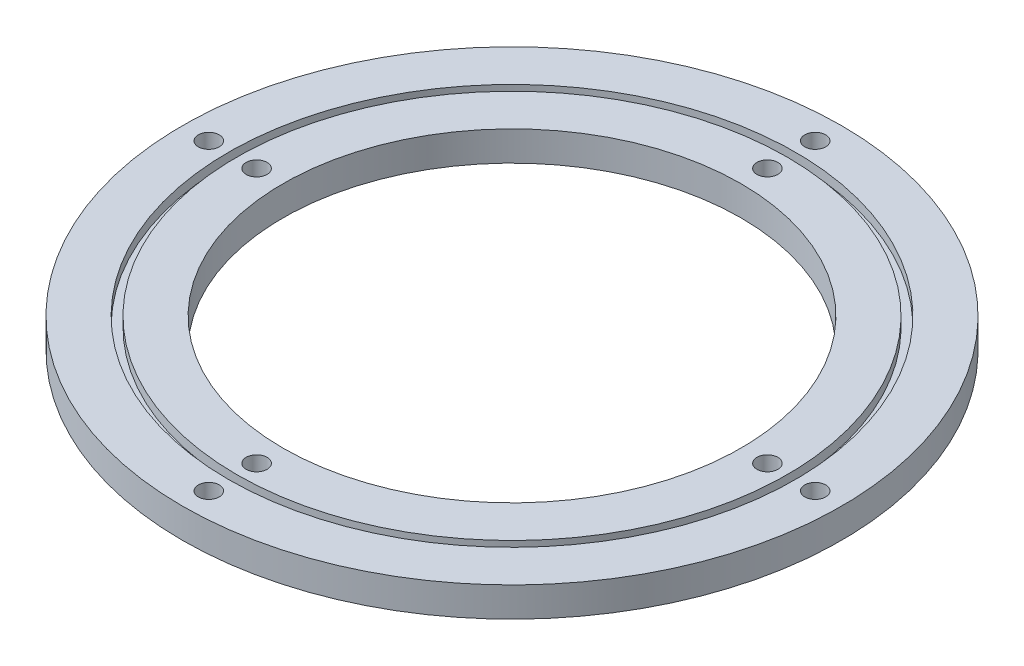
from build123d import *

# Parameters (mm, degrees)
SKETCH1_R             = 100
SKETCH1_R_2           = 3.175
SKETCH1_R_3           = 86.02
BOSS_EXTRUDE1_DEPTH   = 4.5
SKETCH1_R_4           = 83.48
SKETCH1_R_5           = 69.5
BOSS_EXTRUDE1_2_DEPTH = 4.5
SKETCH1_3_R           = 86.02
SKETCH1_3_R_2         = 83.48
BOSS_EXTRUDE2_DEPTH   = 1.5875


with BuildPart() as part:
    # Sketch1 → Boss-Extrude1 (new, symmetric)
    with BuildSketch(Plane(origin=(0, 0, 0), x_dir=(1, 0, 0), z_dir=(0, 1, 0))):
        Circle(SKETCH1_R)
        with Locations((-92, 0)):
            Circle(SKETCH1_R_2, mode=Mode.SUBTRACT)
        with Locations((0, -92)):
            Circle(SKETCH1_R_2, mode=Mode.SUBTRACT)
        with Locations((0, 92)):
            Circle(SKETCH1_R_2, mode=Mode.SUBTRACT)
        Circle(SKETCH1_R_3, mode=Mode.SUBTRACT)
        with Locations((92, 0)):
            Circle(SKETCH1_R_2, mode=Mode.SUBTRACT)
    extrude(amount=BOSS_EXTRUDE1_DEPTH, both=True)



with BuildPart() as body_2:
    # Sketch1 → Boss-Extrude1 2 (new, symmetric)
    with BuildSketch(Plane(origin=(0, 0, 0), x_dir=(1, 0, 0), z_dir=(0, 1, 0))):
        Circle(SKETCH1_R_4)
        with Locations((-77.5, 0)):
            Circle(SKETCH1_R_2, mode=Mode.SUBTRACT)
        with Locations((0, -77.5)):
            Circle(SKETCH1_R_2, mode=Mode.SUBTRACT)
        with Locations((0, 77.5)):
            Circle(SKETCH1_R_2, mode=Mode.SUBTRACT)
        Circle(SKETCH1_R_5, mode=Mode.SUBTRACT)
        with Locations((77.5, 0)):
            Circle(SKETCH1_R_2, mode=Mode.SUBTRACT)
    extrude(amount=BOSS_EXTRUDE1_2_DEPTH, both=True)


with BuildPart() as part_1:
    add(part.part)

    add(body_2.part)  # Boss-Extrude2 merges body 2
    # Sketch1<3> → Boss-Extrude2 (add, symmetric)
    with BuildSketch(Plane(origin=(0, 0, 0), x_dir=(1, 0, 0), z_dir=(0, 1, 0))):
        Circle(SKETCH1_3_R)
        Circle(SKETCH1_3_R_2, mode=Mode.SUBTRACT)
    extrude(amount=BOSS_EXTRUDE2_DEPTH, both=True)


solid = part_1.part
